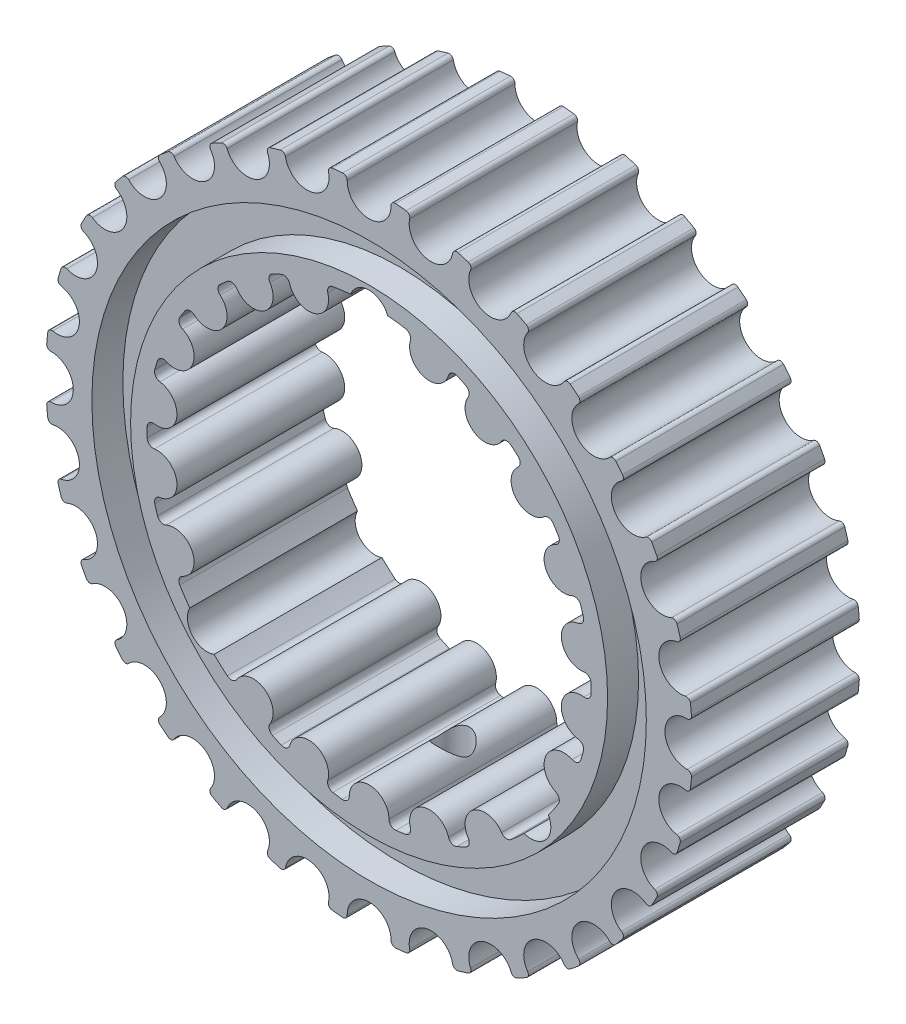
from build123d import *
from build123d.topology import SkipClean

# Parameters (mm, degrees)
BOSS_EXTRUDE1_DEPTH             = 10.31875
CIRPATTERN2_COUNT               = 22
BOSS_EXTRUDE3_REACH             = 42.936
BOSS_EXTRUDE3_DIRECTION_2_REACH = 42.936
CIRPATTERN3_COUNT               = 32
SKETCH7_R                       = 34.097455204
SKETCH7_R_2                     = 29.334955204
CUT_EXTRUDE2_DEPTH              = 3.81
CUT_EXTRUDE3_DEPTH              = 60.752337196
CIRPATTERN9_COUNT               = 11
SKETCH15_W                      = 2.0193
SKETCH15_H                      = 39.651200449


with BuildPart() as part:
    # Sketch1 → Boss-Extrude1 (new, symmetric)
    with BuildSketch(Plane.XY):
        with BuildLine():
            Line((-3.885764344, 27.026084649), (-3.986424042, 27.726188223))
            ThreePointArc((-3.986424042, 27.726188223), (0, 28.011302897), (3.986424042, 27.726188223))
            Line((3.986424042, 27.726188223), (3.885764344, 27.026084649))
            ThreePointArc((3.885764344, 27.026084649), (3.59345262, 27.0665017), (3.30072116, 27.103757227))
            ThreePointArc((3.30072116, 27.103757227), (2.700146019, 26.916923199), (2.441599543, 26.34355493))
            ThreePointArc((2.441599543, 26.34355493), (0, 23.904), (-2.441599543, 26.34355493))
            ThreePointArc((-2.441599543, 26.34355493), (-2.700146019, 26.916923199), (-3.30072116, 27.103757227))
            ThreePointArc((-3.30072116, 27.103757227), (-3.59345262, 27.0665017), (-3.885764344, 27.026084649))
        make_face()
    boss_extrude1 = extrude(amount=BOSS_EXTRUDE1_DEPTH, both=True)

    # CirPattern2: Boss-Extrude1 ×22 about axis
    cirpattern2_axis = Axis((0, 0, 11.350625), (0, 0, -1))
    for i in range(1, CIRPATTERN2_COUNT):
        add(boss_extrude1.rotate(cirpattern2_axis, i * 360 / CIRPATTERN2_COUNT))

    # Boss-Extrude3: up to this face of the body (flat: up to its plane)
    boss_extrude3_end = Plane(part.part.faces().sort_by_distance((3.897039654, 27.104506152, -10.31875))[0])
    # Sketch4 → Boss-Extrude3 (add, up to the picked face)
    with BuildSketch(Plane.XY, mode=Mode.PRIVATE) as boss_extrude3_sk1:
        with BuildLine():
            Line((-3.899358104, 39.590847228), (-2.745587807, 27.876420818))
            ThreePointArc((-2.745587807, 27.876420818), (0, 28.011302897), (2.745587807, 27.876420818))
            Line((2.745587807, 27.876420818), (3.899358104, 39.590847228))
            ThreePointArc((3.899358104, 39.590847228), (3.574473478, 39.621500694), (3.24934834, 39.649488184))
            ThreePointArc((3.24934834, 39.649488184), (2.856685784, 39.512307537), (2.695117452, 39.129034674))
            ThreePointArc((2.695117452, 39.129034674), (0, 36.382410408), (-2.695117452, 39.129034674))
            ThreePointArc((-2.695117452, 39.129034674), (-2.856685784, 39.512307537), (-3.24934834, 39.649488184))
            ThreePointArc((-3.24934834, 39.649488184), (-3.574473478, 39.621500694), (-3.899358104, 39.590847228))
        make_face()
    boss_extrude3_tool1 = split(extrude(boss_extrude3_sk1.sketch, amount=-BOSS_EXTRUDE3_REACH, mode=Mode.PRIVATE), bisect_by=boss_extrude3_end, keep=Keep.BOTH, mode=Mode.PRIVATE)
    boss_extrude3 = boss_extrude3_tool1.solids().sort_by(Axis((0, 33.192205, 0), (0, 0, -1)))[0]
    add(boss_extrude3)

    # Boss-Extrude3 direction 2: up to this face of the body (flat: up to its plane)
    boss_extrude3_direction_2_end = Plane(part.part.faces().sort_by_distance((2.175121058, 27.510265649, 10.31875))[0])
    # Sketch4 → Boss-Extrude3 direction 2 (add, up to the picked face)
    with BuildSketch(Plane.XY, mode=Mode.PRIVATE) as boss_extrude3_direction_2_sk1:
        with BuildLine():
            Line((-3.899358104, 39.590847228), (-2.745587807, 27.876420818))
            ThreePointArc((-2.745587807, 27.876420818), (0, 28.011302897), (2.745587807, 27.876420818))
            Line((2.745587807, 27.876420818), (3.899358104, 39.590847228))
            ThreePointArc((3.899358104, 39.590847228), (3.574473478, 39.621500694), (3.24934834, 39.649488184))
            ThreePointArc((3.24934834, 39.649488184), (2.856685784, 39.512307537), (2.695117452, 39.129034674))
            ThreePointArc((2.695117452, 39.129034674), (0, 36.382410408), (-2.695117452, 39.129034674))
            ThreePointArc((-2.695117452, 39.129034674), (-2.856685784, 39.512307537), (-3.24934834, 39.649488184))
            ThreePointArc((-3.24934834, 39.649488184), (-3.574473478, 39.621500694), (-3.899358104, 39.590847228))
        make_face()
    boss_extrude3_direction_2_tool1 = split(extrude(boss_extrude3_direction_2_sk1.sketch, amount=BOSS_EXTRUDE3_DIRECTION_2_REACH, mode=Mode.PRIVATE), bisect_by=boss_extrude3_direction_2_end, keep=Keep.BOTH, mode=Mode.PRIVATE)
    boss_extrude3_direction_2 = boss_extrude3_direction_2_tool1.solids().sort_by(Axis((0, 33.192205, 0), (0, 0, 1)))[0]
    add(boss_extrude3_direction_2)

    # CirPattern3: Boss-Extrude3, Boss-Extrude3 direction 2 ×32 about axis
    with SkipClean():  # the faces are left unmerged after this step: merging them gives an invalid solid
        cirpattern3_axis = Axis((0, 0, 11.350625), (0, 0, -1))
        add([boss_extrude3.rotate(cirpattern3_axis, i * 360 / CIRPATTERN3_COUNT) for i in range(1, CIRPATTERN3_COUNT)])
        add([boss_extrude3_direction_2.rotate(cirpattern3_axis, i * 360 / CIRPATTERN3_COUNT) for i in range(1, CIRPATTERN3_COUNT)])

    # Sketch7 → Cut-Extrude2 (cut)
    with SkipClean():  # the faces are left unmerged after this step: merging them gives an invalid solid
        with BuildSketch(Plane.XY.offset(10.31875)):
            Circle(SKETCH7_R)
            Circle(SKETCH7_R_2, mode=Mode.SUBTRACT)
        extrude(amount=-CUT_EXTRUDE2_DEPTH, mode=Mode.SUBTRACT)

    # Sketch11 → Cut-Extrude3 (cut, symmetric)
    with SkipClean():  # the faces are left unmerged after this step: merging them gives an invalid solid
        with BuildSketch(Plane.XY.offset(10.31875)):
            with BuildLine():
                ThreePointArc((3.30072116, 27.103757227), (2.700146019, 26.916923199), (2.441599543, 26.34355493))
                ThreePointArc((2.441599543, 26.34355493), (0, 23.904), (-2.441599543, 26.34355493))
                ThreePointArc((-2.441599543, 26.34355493), (-2.700146019, 26.916923199), (-3.30072116, 27.103757227))
                ThreePointArc((-3.30072116, 27.103757227), (-2.792906287, 27.160782214), (-2.284113149, 27.208293646))
                ThreePointArc((-2.284113149, 27.208293646), (0, 28.7872008), (2.284113149, 27.208293646))
                ThreePointArc((2.284113149, 27.208293646), (2.792906287, 27.160782214), (3.30072116, 27.103757227))
            make_face()
        cut_extrude3 = extrude(amount=CUT_EXTRUDE3_DEPTH, both=True, mode=Mode.SUBTRACT)

    # CirPattern9: Cut-Extrude3 ×11 about axis, 8 skipped
    with SkipClean():  # the faces are left unmerged after this step: merging them gives an invalid solid
        cirpattern9_axis = Axis((0, 0, 11.350625), (0, 0, -1))
        add([cut_extrude3.rotate(cirpattern9_axis, i * 360 / CIRPATTERN9_COUNT) for i in range(1, CIRPATTERN9_COUNT) if i not in (1, 2, 3, 5, 6, 8, 9, 10)], mode=Mode.SUBTRACT)

    # Sketch15 → #10-32 Tapped Hole1 (revolve, cut)
    with SkipClean():  # the faces are left unmerged after this step: merging them gives an invalid solid
        with BuildSketch(Plane(origin=(0, 0, 0), x_dir=(0, 0, 1), z_dir=(1, 0, 0))):
            with Locations((1.00965, 19.825600225)):
                Rectangle(SKETCH15_W, SKETCH15_H)
        revolve(axis=Axis((0, 6.35, 0), (0, -1, 0)), mode=Mode.SUBTRACT)


solid = part.part
